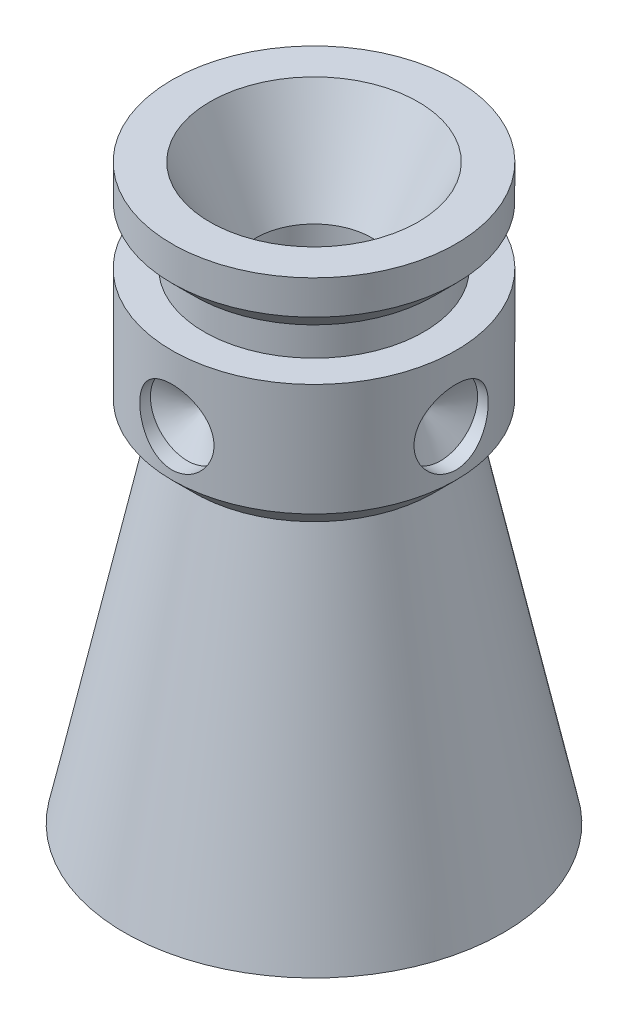
from build123d import *

# Parameters (mm, degrees)
CIRPATTERN1_COUNT = 4
CHAMFER1_SIZE     = 1.524


with BuildPart() as part:
    # Sketch1 → Body (revolve)
    with BuildSketch(Plane.XY):
        Polygon((-12.7, -38.416258567), (-10.16, -38.416258567), (-3.884, -8.89), (-3.884, -6.35), (-6.985, 0), (-9.525, 0), (-9.525, -3.81), (-7.366, -3.81), (-7.366, -6.19125), (-9.525, -6.19125), (-9.525, -15.24), (-7.773734167, -15.24), align=None)
    revolve(axis=Axis((0, 0, 0), (0, -1, 0)))

    # Sketch4 → SetScrew (revolve, cut)
    with BuildSketch(Plane(origin=(-9.525, -10.63625, 0), x_dir=(0, 0, 1), z_dir=(0, 1, 0))):
        Polygon((0, 0), (0, 2.54), (2.4892, 1.044337747), (2.4892, 0), align=None)
    setscrew = revolve(axis=Axis((-15.875, -10.63625, 0), (1, 0, 0)), mode=Mode.SUBTRACT)

    # CirPattern1: SetScrew ×4 about axis
    cirpattern1_axis = Axis((0, 0, 0), (0, 1, 0))
    for i in range(1, CIRPATTERN1_COUNT):
        add(setscrew.rotate(cirpattern1_axis, i * 360 / CIRPATTERN1_COUNT), mode=Mode.SUBTRACT)

    # Chamfer1
    chamfer1_edges = [part.edges().sort_by_distance(p)[0] for p in [
        (9.525, -3.81, 0),
        (9.525, -15.24, 0),
    ]]
    chamfer(chamfer1_edges, length=CHAMFER1_SIZE)


solid = part.part
